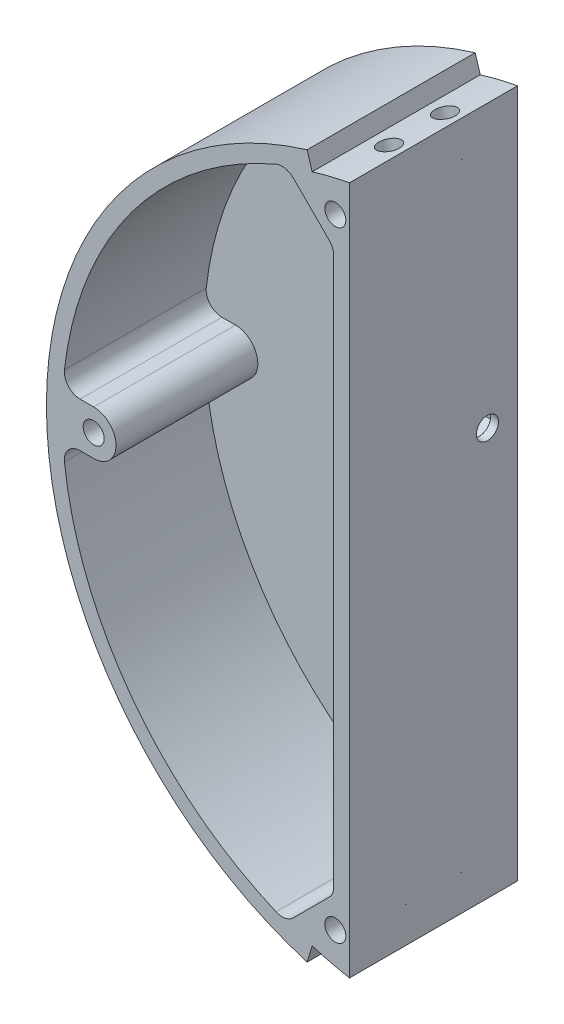
from build123d import *
from build123d.topology import SkipClean

# Parameters (mm, degrees)
SKETCH1_R                 = 1.25
BOSS_EXTRUDE2_DEPTH       = 32
SHELL1_T                  = -3
SKETCH10_R                = 4.25
SKETCH10_R_2              = 1.25
BOSS_EXTRUDE6_DEPTH       = 29
FILLET1_R                 = 3
SKETCH11_R                = 2.1
CUT_EXTRUDE4_DEPTH        = 5
SKETCH12_R                = 2
THREAD_INSERT_HOLES_DEPTH = 4.78
CUT_EXTRUDE6_START        = -4.78
SKETCH13_R                = 2
CUT_EXTRUDE6_DEPTH        = 4.78
CUT_EXTRUDE7_DEPTH        = 32
SKETCH16_R                = 1.65
CUT_EXTRUDE8_DEPTH        = 10
SKETCH17_R                = 1.65
CUT_EXTRUDE9_DEPTH        = 10
SKETCH18_R                = 2
CUT_EXTRUDE10_DEPTH       = 8
SKETCH19_R                = 2
CUT_EXTRUDE11_DEPTH       = 8
BOSS_EXTRUDE8_DEPTH       = 2
CUT_EXTRUDE12_DEPTH       = 5
CUT_EXTRUDE12_DEPTH_BACK  = 1.5
CUT_EXTRUDE13_DEPTH       = 1.5


with BuildPart() as part:
    # Sketch1 → Boss-Extrude2 (new body)
    with BuildSketch(Plane.XY):
        with BuildLine():
            Line((-12.3, -68.910884481), (-12.3, 68.910884481))
            ThreePointArc((-12.3, 68.910884481), (-70, 0), (-12.3, -68.910884481))
        make_face()
        with Locations((-15, 59)):
            Circle(SKETCH1_R, mode=Mode.SUBTRACT)
        with Locations((-61, 0)):
            Circle(SKETCH1_R, mode=Mode.SUBTRACT)
        with Locations((-15, -59)):
            Circle(SKETCH1_R, mode=Mode.SUBTRACT)
    extrude(amount=BOSS_EXTRUDE2_DEPTH)

    # Shell1
    shell1_openings = [part.faces().sort_by_distance(p)[0] for p in [
        (-36.473274769, 0, 32),
    ]]
    offset(amount=SHELL1_T, openings=shell1_openings)

    # Sketch10 → Boss-Extrude6 (add)
    # profile 1 of 8: a face of its own
    with SkipClean():  # the faces are left unmerged after this step: merging them gives an invalid solid
        with BuildSketch(Plane.XY.offset(3)):
            with BuildLine():
                ThreePointArc((-63.588029534, 4.25), (-65.826280106, 5.252442898), (-66.568718418, 7.58984375))
                ThreePointArc((-66.568718418, 7.58984375), (-67, 0), (-66.568718418, -7.58984375))
                ThreePointArc((-66.568718418, -7.58984375), (-65.826280106, -5.252442898), (-63.588029534, -4.25))
                Line((-63.588029534, -4.25), (-61, -4.25))
                ThreePointArc((-61, -4.25), (-65.25, 0), (-61, 4.25))
                Line((-61, 4.25), (-63.588029534, 4.25))
            make_face()
        # profile 2 of 8: a face of its own
        with BuildSketch(Plane.XY.offset(3)):
            with Locations((-61, 0)):
                Circle(SKETCH10_R)
            with Locations((-61, 0)):
                Circle(SKETCH10_R_2, mode=Mode.SUBTRACT)
        # profile 3 of 8: a face of its own
        with BuildSketch(Plane.XY.offset(3)):
            with BuildLine():
                ThreePointArc((-15.3, -54.760601458), (-16.764058495, -55.133399733), (-18.005203885, -55.994796245))
                ThreePointArc((-18.005203885, -55.994796245), (-18.981476961, -60.486721631), (-15.3, -63.239398542))
                Line((-15.3, -63.239398542), (-15.3, -60.21346611))
                ThreePointArc((-15.3, -60.21346611), (-16.25, -59), (-15.3, -57.78653389))
                Line((-15.3, -57.78653389), (-15.3, -54.760601458))
            make_face()
        # profile 4 of 8: a face of its own
        with BuildSketch(Plane.XY.offset(3)):
            with BuildLine():
                ThreePointArc((-15.3, -63.239398542), (-18.981476961, -60.486721631), (-18.005203885, -55.994796245))
                Line((-18.005203885, -55.994796245), (-24.406790405, -62.396382765))
                ThreePointArc((-24.406790405, -62.396382765), (-19.903873539, -63.975275053), (-15.3, -65.229671163))
                Line((-15.3, -65.229671163), (-15.3, -63.239398542))
            make_face()
        # profile 5 of 8: a face of its own
        with BuildSketch(Plane.XY.offset(3)):
            with BuildLine():
                Line((-24.406790405, 62.396382765), (-18.005203612, 55.994795972))
                ThreePointArc((-18.005203612, 55.994795972), (-18.981477029, 60.48672145), (-15.3, 63.239398542))
                Line((-15.3, 63.239398542), (-15.3, 65.229671163))
                ThreePointArc((-15.3, 65.229671163), (-19.903873539, 63.975275053), (-24.406790405, 62.396382765))
            make_face()
        # profile 6 of 8: a face of its own
        with BuildSketch(Plane.XY.offset(3)):
            with BuildLine():
                ThreePointArc((-15.3, 63.239398542), (-18.981477029, 60.48672145), (-18.005203612, 55.994795972))
                ThreePointArc((-18.005203612, 55.994795972), (-16.764058319, 55.133399653), (-15.3, 54.760601458))
                Line((-15.3, 54.760601458), (-15.3, 57.78653389))
                ThreePointArc((-15.3, 57.78653389), (-16.25, 59), (-15.3, 60.21346611))
                Line((-15.3, 60.21346611), (-15.3, 63.239398542))
            make_face()
        # profile 7 of 8: a face of its own
        with BuildSketch(Plane.XY.offset(3)):
            with BuildLine():
                Line((-15.3, -54.760601458), (-15.3, -53.28959236))
                Line((-15.3, -53.28959236), (-18.005203885, -55.994796245))
                ThreePointArc((-18.005203885, -55.994796245), (-16.764058495, -55.133399733), (-15.3, -54.760601458))
            make_face()
        # profile 8 of 8: a face of its own
        with BuildSketch(Plane.XY.offset(3)):
            with BuildLine():
                Line((-18.005203612, 55.994795972), (-15.3, 53.28959236))
                Line((-15.3, 53.28959236), (-15.3, 54.760601458))
                ThreePointArc((-15.3, 54.760601458), (-16.764058319, 55.133399653), (-18.005203612, 55.994795972))
            make_face()
        extrude(amount=BOSS_EXTRUDE6_DEPTH)

    # Fillet1
    fillet1_edges = [part.edges().sort_by_distance(p)[0] for p in [
        (-15.3, -53.28959236, 17.5),
        (-24.406790405, -62.396382765, 17.5),
        (-24.406790405, 62.396382765, 17.5),
        (-15.3, 53.28959236, 17.5),
    ]]
    fillet(fillet1_edges, radius=FILLET1_R)

    # Sketch11 → Cut-Extrude4 (cut)
    with SkipClean():  # the faces are left unmerged after this step: merging them gives an invalid solid
        with BuildSketch(Plane(origin=(-12.3, 0, 0), x_dir=(0, 0, -1), z_dir=(1, 0, 0))):
            with Locations((-5.75, 12)):
                Circle(SKETCH11_R)
        extrude(amount=-CUT_EXTRUDE4_DEPTH, mode=Mode.SUBTRACT)

    # Sketch12 → Thread insert holes (cut)
    with SkipClean():  # the faces are left unmerged after this step: merging them gives an invalid solid
        with BuildSketch(Plane.XY.offset(32)):
            with Locations((-15, -59)):
                Circle(SKETCH12_R)
            with Locations((-61, 0)):
                Circle(SKETCH12_R)
            with Locations((-15, 59)):
                Circle(SKETCH12_R)
        extrude(amount=-THREAD_INSERT_HOLES_DEPTH, mode=Mode.SUBTRACT)

    # Sketch13 → Cut-Extrude6 (cut)
    with SkipClean():  # the faces are left unmerged after this step: merging them gives an invalid solid
        with BuildSketch(Plane(origin=(0, 0, 0), x_dir=(-1, 0, 0), z_dir=(0, 0, -1)).offset(CUT_EXTRUDE6_START)):
            with Locations(Location((15, 59, 0), (0, 0, 180))):
                Circle(SKETCH13_R)
            with Locations(Location((61, 0, 0), (0, 0, 180))):
                Circle(SKETCH13_R)
            with Locations(Location((15, -59, 0), (0, 0, 180))):
                Circle(SKETCH13_R)
        extrude(amount=CUT_EXTRUDE6_DEPTH, mode=Mode.SUBTRACT)

    # Sketch14 → Cut-Extrude7 (cut)
    with SkipClean():  # the faces are left unmerged after this step: merging them gives an invalid solid
        with BuildSketch(Plane.XY):
            with BuildLine():
                Line((-19.405285226, -63.814770275), (-20.365366804, -66.972022778))
                ThreePointArc((-20.365366804, -66.972022778), (-16.361428522, -68.061028913), (-12.3, -68.910884481))
                Line((-12.3, -68.910884481), (-12.3, -65.55608286))
                ThreePointArc((-12.3, -65.55608286), (-15.876533633, -64.782911943), (-19.405285226, -63.814770275))
            make_face()
            with BuildLine():
                Line((-19.405285226, 63.814770275), (-20.365366804, 66.972022778))
                ThreePointArc((-20.365366804, 66.972022778), (-16.361428522, 68.061028913), (-12.3, 68.910884481))
                Line((-12.3, 68.910884481), (-12.3, 65.55608286))
                ThreePointArc((-12.3, 65.55608286), (-15.876533633, 64.782911943), (-19.405285226, 63.814770275))
            make_face()
        extrude(amount=CUT_EXTRUDE7_DEPTH, mode=Mode.SUBTRACT)

    # Sketch16 → Cut-Extrude8 (cut)
    with SkipClean():  # the faces are left unmerged after this step: merging them gives an invalid solid
        with BuildSketch(Plane(origin=(-16.215546007, 68.095932828, 0), x_dir=(0.9727990403970517, 0.23165065724615486, 0), z_dir=(-0.23165065724615483, 0.9727990403970516, 0))):
            with Locations(Location((0, -10.666666667, 0), (0, 0, 180))):
                Circle(SKETCH16_R)
            with Locations(Location((0, -21.333333333, 0), (0, 0, 180))):
                Circle(SKETCH16_R)
        extrude(amount=-CUT_EXTRUDE8_DEPTH, mode=Mode.SUBTRACT)

    # Sketch17 → Cut-Extrude9 (cut)
    with SkipClean():  # the faces are left unmerged after this step: merging them gives an invalid solid
        with BuildSketch(Plane(origin=(-16.215546007, -68.095932828, 0), x_dir=(-0.9727990403970517, 0.2316506572461547, 0), z_dir=(-0.2316506572461547, -0.9727990403970517, 0))):
            with Locations(Location((0, -10.666666667, 0), (0, 0, 180))):
                Circle(SKETCH17_R)
            with Locations(Location((0, -21.333333333, 0), (0, 0, 180))):
                Circle(SKETCH17_R)
        extrude(amount=-CUT_EXTRUDE9_DEPTH, mode=Mode.SUBTRACT)

    # Sketch18 → Cut-Extrude10 (cut)
    with SkipClean():  # the faces are left unmerged after this step: merging them gives an invalid solid
        with BuildSketch(Plane(origin=(-16.215546007, 68.095932828, 0), x_dir=(0.9727990403970517, 0.23165065724615486, 0), z_dir=(-0.23165065724615483, 0.9727990403970516, 0))):
            with Locations(Location((0, -10.666666667, 0), (0, 0, 180))):
                Circle(SKETCH18_R)
            with Locations(Location((0, -21.333333333, 0), (0, 0, 180))):
                Circle(SKETCH18_R)
        extrude(amount=-CUT_EXTRUDE10_DEPTH, mode=Mode.SUBTRACT)

    # Sketch19 → Cut-Extrude11 (cut)
    with SkipClean():  # the faces are left unmerged after this step: merging them gives an invalid solid
        with BuildSketch(Plane(origin=(-16.215546007, -68.095932828, 0), x_dir=(-0.9727990403970517, 0.2316506572461547, 0), z_dir=(-0.2316506572461547, -0.9727990403970517, 0))):
            with Locations(Location((0, -10.666666667, 0), (0, 0, 180))):
                Circle(SKETCH19_R)
            with Locations(Location((0, -21.333333333, 0), (0, 0, 180))):
                Circle(SKETCH19_R)
        extrude(amount=-CUT_EXTRUDE11_DEPTH, mode=Mode.SUBTRACT)

    # Sketch23 → Boss-Extrude8 (add)
    with SkipClean():  # the faces are left unmerged after this step: merging them gives an invalid solid
        with BuildSketch(Plane.XY.offset(3)):
            with BuildLine():
                Line((-15.3, -52.046951673), (-15.3, 52.046951673))
                ThreePointArc((-15.3, 52.046951673), (-15.528361402, 53.19500197), (-16.178679656, 54.168272016))
                Line((-16.178679656, 54.168272016), (-22.996700735, 60.986293095))
                ThreePointArc((-22.996700735, 60.986293095), (-24.548375493, 61.810393589), (-26.295428317, 61.62426835))
                ThreePointArc((-26.295428317, 61.62426835), (-53.720268034, 40.039140879), (-66.568718418, 7.58984375))
                ThreePointArc((-66.568718418, 7.58984375), (-65.826280106, 5.252442898), (-63.588029534, 4.25))
                Line((-63.588029534, 4.25), (-61, 4.25))
                ThreePointArc((-61, 4.25), (-56.75, 0), (-61, -4.25))
                Line((-61, -4.25), (-63.588029534, -4.25))
                ThreePointArc((-63.588029534, -4.25), (-65.826280106, -5.252442898), (-66.568718418, -7.58984375))
                ThreePointArc((-66.568718418, -7.58984375), (-53.720268034, -40.039140879), (-26.295428317, -61.62426835))
                ThreePointArc((-26.295428317, -61.62426835), (-24.548375493, -61.810393589), (-22.996700735, -60.986293095))
                Line((-22.996700735, -60.986293095), (-16.178679656, -54.168272016))
                ThreePointArc((-16.178679656, -54.168272016), (-15.528361402, -53.19500197), (-15.3, -52.046951673))
            make_face()
        extrude(amount=BOSS_EXTRUDE8_DEPTH)

    # Sketch20 → Cut-Extrude12 (cut, two sides: drawn at the far end of the back side and taken through both)
    with SkipClean():  # the faces are left unmerged after this step: merging them gives an invalid solid
        with BuildSketch(Plane.ZY.offset(15.3).offset(-CUT_EXTRUDE12_DEPTH_BACK)):
            Polygon((5.75, 7.207992766), (9.9, 9.603996383), (9.9, 14.396003617), (5.75, 16.792007234), (1.6, 14.396003617), (1.6, 9.603996383), align=None)
        extrude(amount=CUT_EXTRUDE12_DEPTH + CUT_EXTRUDE12_DEPTH_BACK, mode=Mode.SUBTRACT)

    # Sketch24 → Cut-Extrude13 (cut)
    with SkipClean():  # the faces are left unmerged after this step: merging them gives an invalid solid
        with BuildSketch(Plane.ZY.offset(15.3)):
            Polygon((5.75, 16.792007234), (10.5, 14.5), (10.5, 9.5), (5.75, 7.207992766), (9.9, 9.603996383), (9.9, 14.396003617), align=None)
        extrude(amount=-CUT_EXTRUDE13_DEPTH, mode=Mode.SUBTRACT)


solid = part.part
